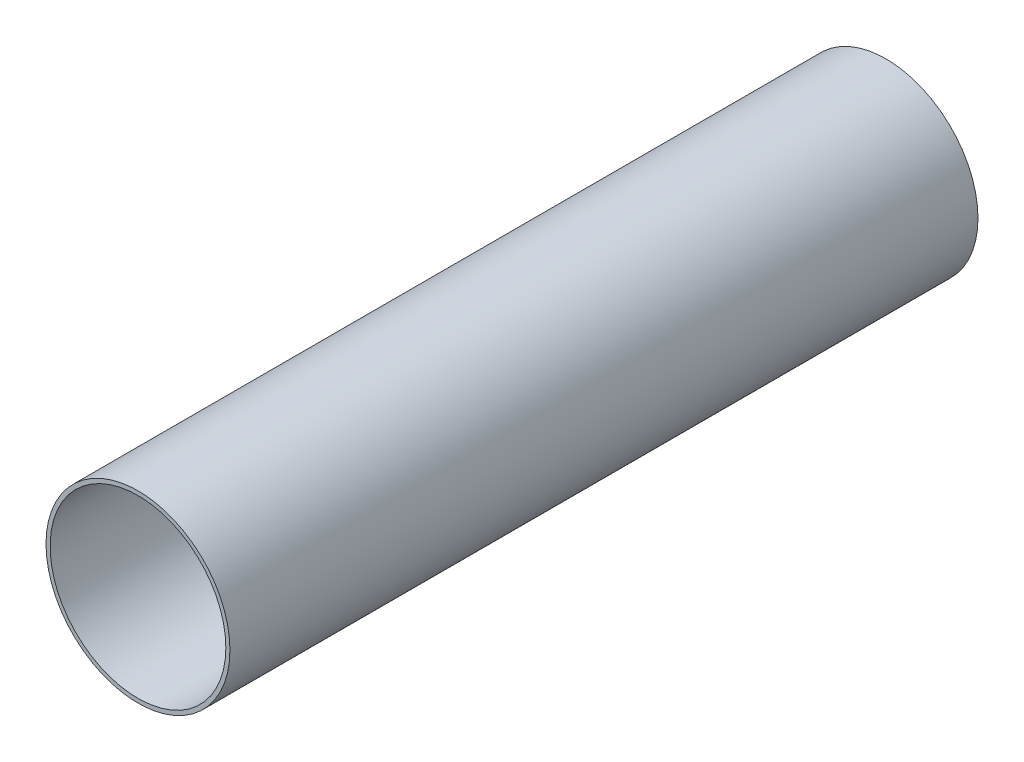
from build123d import *

# Parameters (mm, degrees)
SKETCH1_R           = 33.65
SKETCH1_R_2         = 32.15
BOSS_EXTRUDE1_DEPTH = 273.7


with BuildPart() as part:
    # Sketch1 → Boss-Extrude1 (new body)
    with BuildSketch(Plane(origin=(0, 0, 0), x_dir=(0, 1, 0), z_dir=(0, 0, 1))):
        with Locations(Location((0, 0, 0), (0, 0, 270))):
            Circle(SKETCH1_R)
        with Locations(Location((0, 0, 0), (0, 0, 270))):
            Circle(SKETCH1_R_2, mode=Mode.SUBTRACT)
    extrude(amount=BOSS_EXTRUDE1_DEPTH)


solid = part.part
